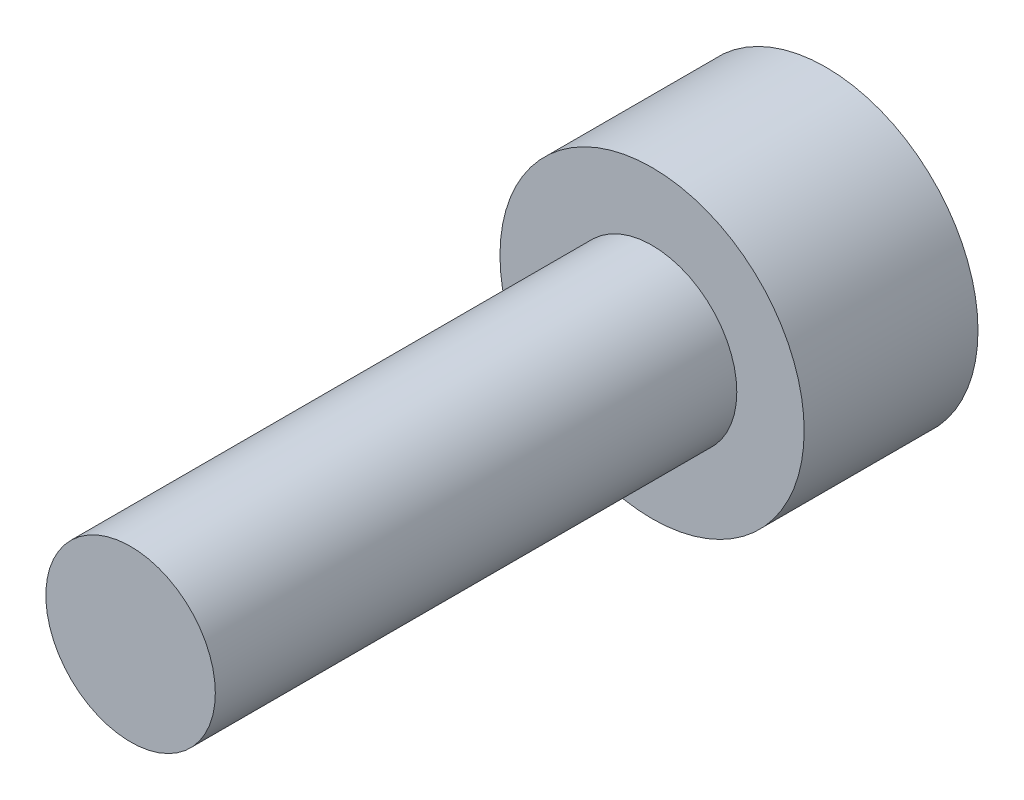
from build123d import *

# Parameters (mm, degrees)
SKETCH_1_R      = 1.95
EXTRUDE_1_DEPTH = 12
SKETCH_2_R      = 3.5
EXTRUDE_2_DEPTH = 4


with BuildPart() as part:
    # 스케치1 → 보스-돌출1 (new body)
    with BuildSketch(Plane.XY):
        Circle(SKETCH_1_R)
    extrude(amount=EXTRUDE_1_DEPTH)

    # 스케치2 → 보스-돌출2 (add)
    with BuildSketch(Plane.XY):
        Circle(SKETCH_2_R)
    extrude(amount=-EXTRUDE_2_DEPTH)


solid = part.part
